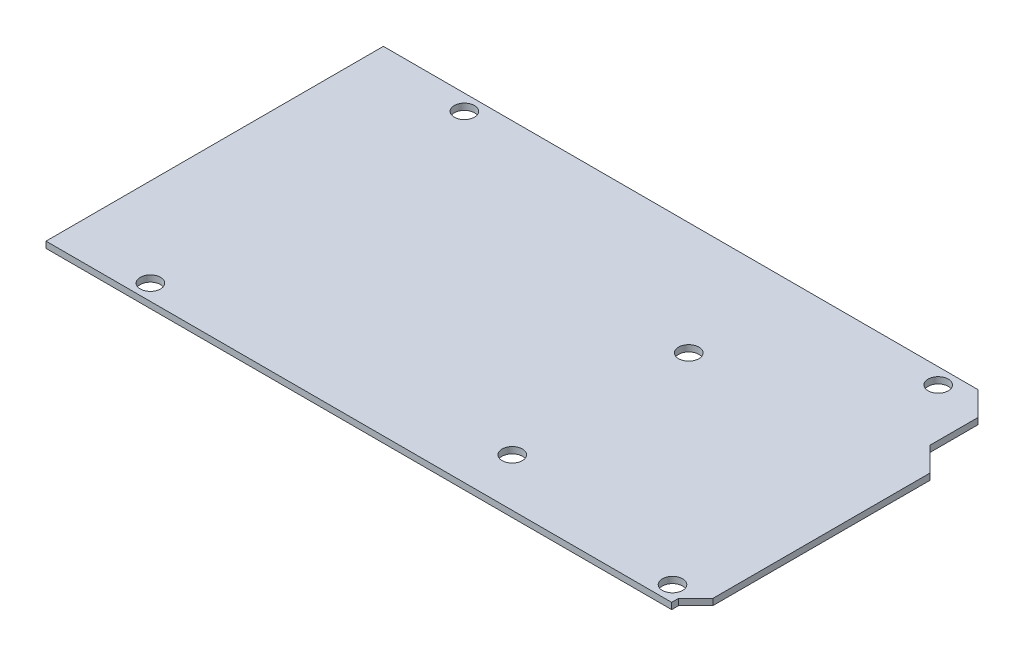
from build123d import *

# Parameters (mm, degrees)
SKETCH1_R              = 1.6
ARDUINO_TEMPLATE_DEPTH = 1


with BuildPart() as part:
    # Sketch1 → Arduino Template (new body)
    # profile 1 of 3: a face of its own
    with BuildSketch(Plane(origin=(0, 0, 0), x_dir=(1, 0, 0), z_dir=(0, 1, 0))):
        Polygon((101.61, 3.81), (101.61, 38.09), (97.8, 38.09), (97.8, 41.9), (97.8, 49.52), (93.99, 53.33), (0, 53.33), (0, 0), (97.8, 0), (98.9, 1.1), align=None)
        with Locations(Location((14, 2.5, 0), (0, 0, 270))):
            Circle(SKETCH1_R, mode=Mode.SUBTRACT)
        with Locations(Location((66.1, 7.6, 0), (0, 0, 270))):
            Circle(SKETCH1_R, mode=Mode.SUBTRACT)
        with Locations(Location((96.53, 2.5, 0), (0, 0, 270))):
            Circle(SKETCH1_R, mode=Mode.SUBTRACT)
        with Locations(Location((15.3, 50.83, 0), (0, 0, 270))):
            Circle(SKETCH1_R, mode=Mode.SUBTRACT)
        with Locations(Location((66.1, 35.5, 0), (0, 0, 270))):
            Circle(SKETCH1_R, mode=Mode.SUBTRACT)
        with Locations(Location((90.2, 50.83, 0), (0, 0, 270))):
            Circle(SKETCH1_R, mode=Mode.SUBTRACT)
    # profile 2 of 3: a face of its own
    with BuildSketch(Plane(origin=(0, 0, 0), x_dir=(1, 0, 0), z_dir=(0, 1, 0))):
        Polygon((98.9, 0), (98.9, 1.1), (97.8, 0), align=None)
    # profile 3 of 3: a face of its own
    with BuildSketch(Plane(origin=(0, 0, 0), x_dir=(1, 0, 0), z_dir=(0, 1, 0))):
        Polygon((97.8, 38.09), (101.61, 38.09), (97.8, 41.9), align=None)
    extrude(amount=ARDUINO_TEMPLATE_DEPTH)


solid = part.part
